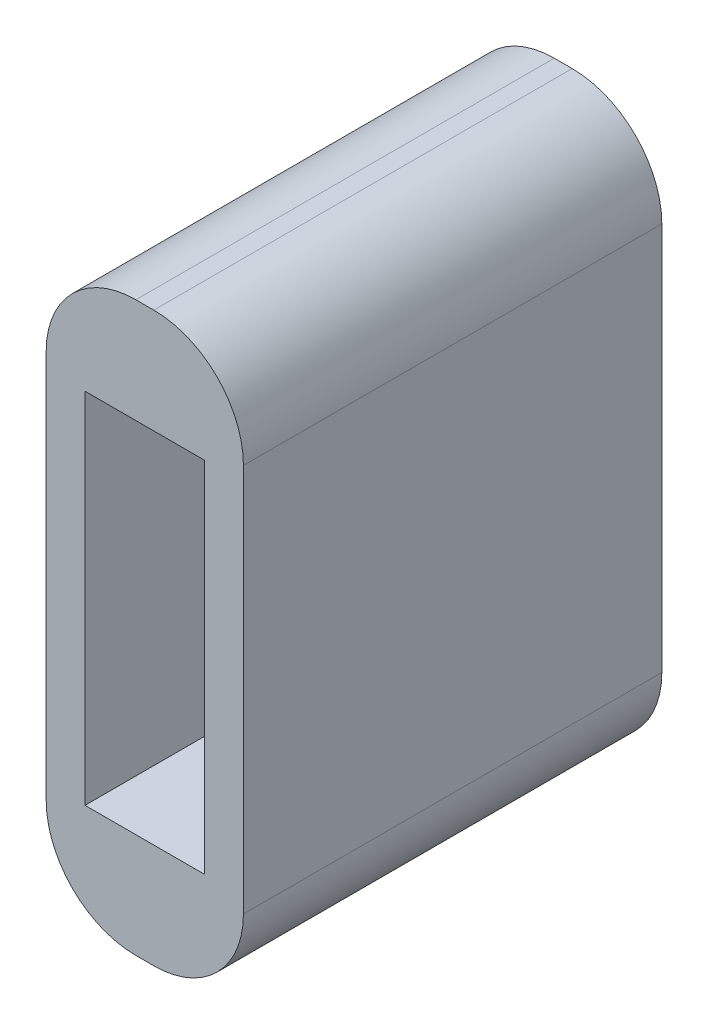
from build123d import *

# Parameters (mm, degrees)
SKETCH1_W           = 3.3
SKETCH1_H           = 9.5
BOSS_EXTRUDE1_DEPTH = 7
FILLET1_R           = 1.5
SKETCH2_W           = 2
SKETCH2_H           = 6
CUT_EXTRUDE1_DEPTH  = 7


with BuildPart() as part:
    # Sketch1 → Boss-Extrude1 (new body)
    with BuildSketch(Plane.XY):
        Rectangle(SKETCH1_W, SKETCH1_H)
    extrude(amount=BOSS_EXTRUDE1_DEPTH)

    # Fillet1
    fillet1_edges = [part.edges().sort_by_distance(p)[0] for p in [
        (1.65, -4.75, 3.5),
        (-1.65, -4.75, 3.5),
        (-1.65, 4.75, 3.5),
        (1.65, 4.75, 3.5),
    ]]
    fillet(fillet1_edges, radius=FILLET1_R)

    # Sketch2 → Cut-Extrude1 (cut)
    with BuildSketch(Plane.XY.offset(7)):
        Rectangle(SKETCH2_W, SKETCH2_H)
    extrude(amount=-CUT_EXTRUDE1_DEPTH, mode=Mode.SUBTRACT)


solid = part.part
